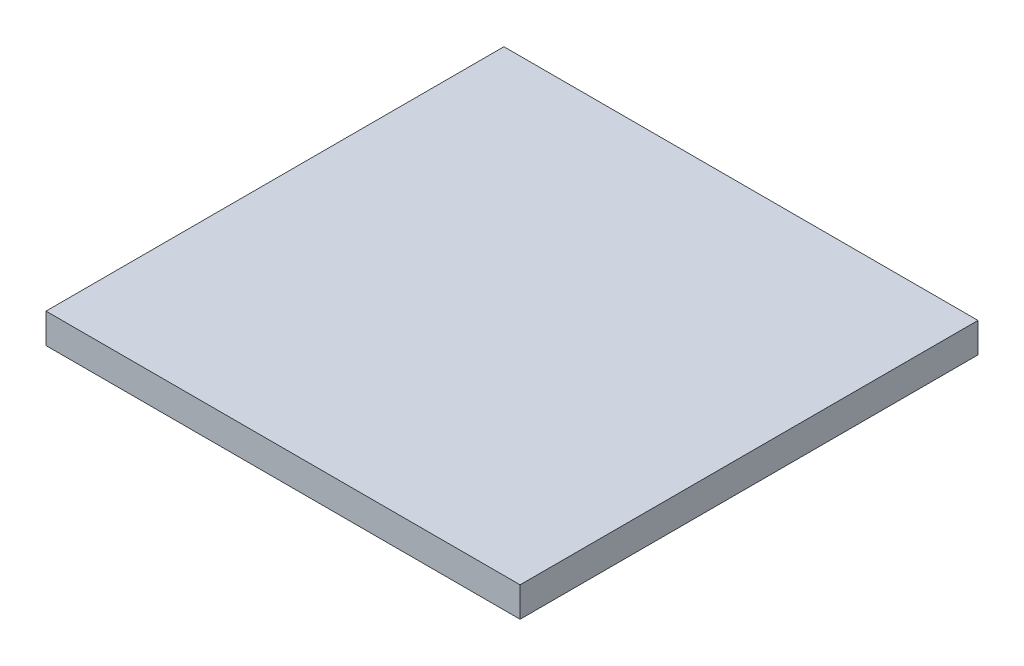
from build123d import *

# Parameters (mm, degrees)
SKETCH_1_W      = 238.11
SKETCH_1_H      = 230
EXTRUDE_1_DEPTH = 15


with BuildPart() as part:
    # 草图1 → 凸台-拉伸1 (new body)
    with BuildSketch(Plane(origin=(0, 0, 0), x_dir=(1, 0, 0), z_dir=(0, 1, 0))):
        Rectangle(SKETCH_1_W, SKETCH_1_H)
    extrude(amount=EXTRUDE_1_DEPTH)


solid = part.part
